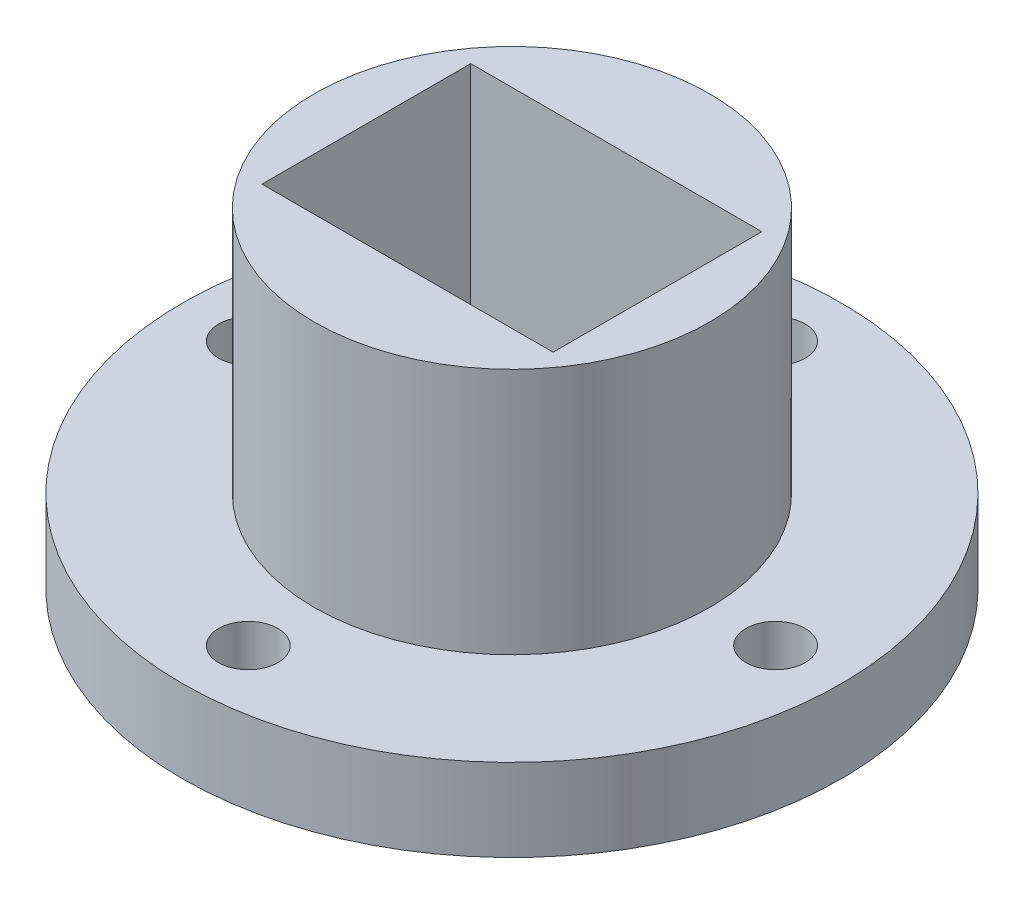
from build123d import *

# Parameters (mm, degrees)
SKETCH1_R           = 6
SKETCH1_W           = 5.3
SKETCH1_H           = 3.8
BOSS_EXTRUDE1_DEPTH = 6
SKETCH6_W           = 2.4
SKETCH6_H           = 4.5
SKETCH10_R          = 0.54
CUT_EXTRUDE2_DEPTH  = 60


with BuildPart() as part:
    # Sketch1 → Boss-Extrude1 (new body)
    with BuildSketch(Plane(origin=(0, 0, 0), x_dir=(1, 0, 0), z_dir=(0, 1, 0))):
        with Locations(Location((0, 0, 0), (0, 0, 270))):
            Circle(SKETCH1_R)
        Rectangle(SKETCH1_W, SKETCH1_H, mode=Mode.SUBTRACT)
    extrude(amount=BOSS_EXTRUDE1_DEPTH)

    # Sketch6 → Cut-Revolve1 (revolve, cut)
    with BuildSketch(Plane(origin=(0, 0, 0), x_dir=(0, 0, -1), z_dir=(1, 0, 0))):
        with Locations((-4.8, 3.75)):
            Rectangle(SKETCH6_W, SKETCH6_H)
    revolve(axis=Axis((0, 6, 0), (0, -1, 0)), mode=Mode.SUBTRACT)

    # Sketch10 → Cut-Extrude2 (cut)
    with BuildSketch(Plane(origin=(0, 1.5, 0), x_dir=(1, 0, 0), z_dir=(0, 1, 0))):
        with Locations(Location((-4.8, 0, 0), (0, 0, 270))):
            Circle(SKETCH10_R)
        with Locations(Location((0, -4.8, 0), (0, 0, 270))):
            Circle(SKETCH10_R)
        with Locations(Location((4.8, 0, 0), (0, 0, 270))):
            Circle(SKETCH10_R)
        with Locations(Location((0, 4.8, 0), (0, 0, 270))):
            Circle(SKETCH10_R)
    extrude(amount=-CUT_EXTRUDE2_DEPTH, mode=Mode.SUBTRACT)


solid = part.part
